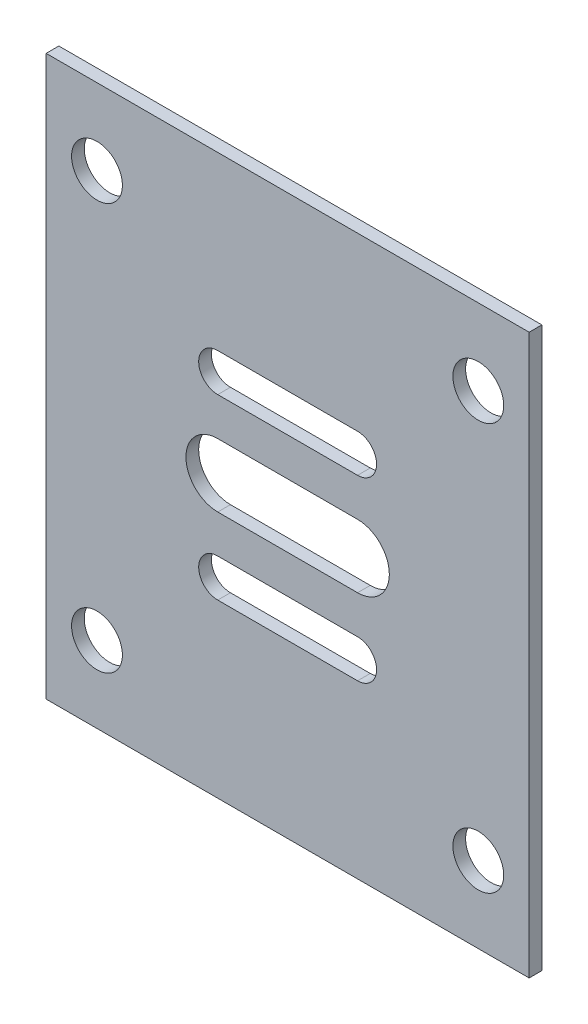
from build123d import *

# Parameters (mm, degrees)
SKETCH1_W           = 38
SKETCH1_H           = 44
SKETCH1_R           = 2
BOSS_EXTRUDE1_DEPTH = 1


with BuildPart() as part:
    # Sketch1 → Boss-Extrude1 (new body)
    with BuildSketch(Plane.XY):
        with Locations((19, 22)):
            Rectangle(SKETCH1_W, SKETCH1_H)
        with Locations((4, 38)):
            Circle(SKETCH1_R, mode=Mode.SUBTRACT)
        with Locations((34, 38)):
            Circle(SKETCH1_R, mode=Mode.SUBTRACT)
        with Locations((34, 6)):
            Circle(SKETCH1_R, mode=Mode.SUBTRACT)
        with Locations((4, 6)):
            Circle(SKETCH1_R, mode=Mode.SUBTRACT)
        with BuildLine():
            Line((13.5, 24.5), (24.5, 24.5))
            ThreePointArc((24.5, 24.5), (27, 22), (24.5, 19.5))
            Line((24.5, 19.5), (13.5, 19.5))
            ThreePointArc((13.5, 19.5), (11, 22), (13.5, 24.5))
        make_face(mode=Mode.SUBTRACT)
        with BuildLine():
            Line((13.5, 30.5), (24.5, 30.5))
            ThreePointArc((24.5, 30.5), (26, 29), (24.5, 27.5))
            Line((24.5, 27.5), (13.5, 27.5))
            ThreePointArc((13.5, 27.5), (12, 29), (13.5, 30.5))
        make_face(mode=Mode.SUBTRACT)
        with BuildLine():
            Line((13.5, 16.5), (24.5, 16.5))
            ThreePointArc((24.5, 16.5), (26, 15), (24.5, 13.5))
            Line((24.5, 13.5), (13.5, 13.5))
            ThreePointArc((13.5, 13.5), (12, 15), (13.5, 16.5))
        make_face(mode=Mode.SUBTRACT)
    extrude(amount=BOSS_EXTRUDE1_DEPTH)


solid = part.part
